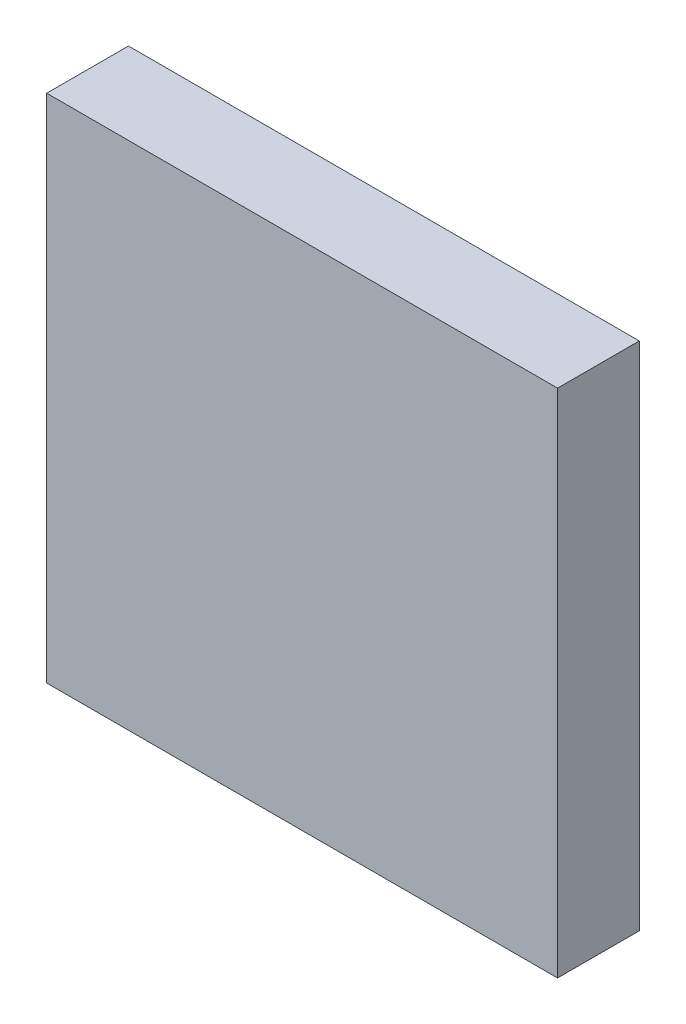
from build123d import *

# Parameters (mm, degrees)
SKETCH_1_W      = 25
SKETCH_1_H      = 25
EXTRUDE_1_DEPTH = 4


with BuildPart() as part:
    # 草圖1 → 填料-伸長1 (new body)
    with BuildSketch(Plane.XY):
        Rectangle(SKETCH_1_W, SKETCH_1_H)
    extrude(amount=EXTRUDE_1_DEPTH)


solid = part.part
